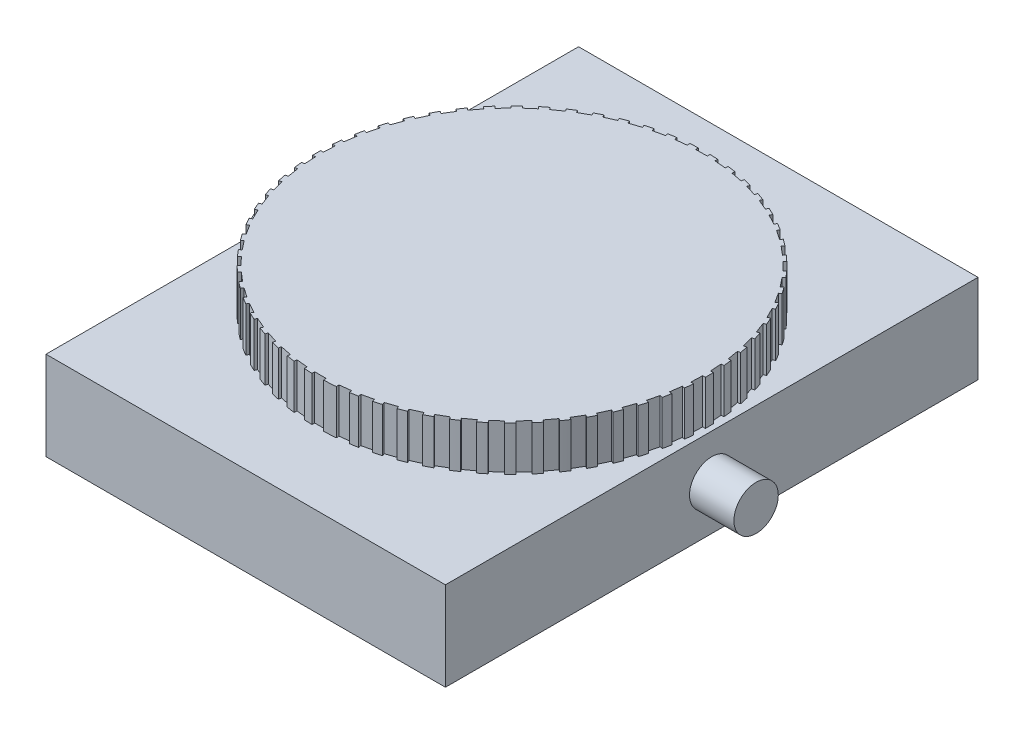
from build123d import *

# Parameters (mm, degrees)
SKETCH1_W           = 114.3
SKETCH1_H           = 152.4
BOSS_EXTRUDE1_DEPTH = 25.4
SKETCH2_R           = 55.610896722
BOSS_EXTRUDE2_DEPTH = 12.7
SKETCH3_W           = 3.278174466
SKETCH3_H           = 6.795753609
CUT_EXTRUDE1_DEPTH  = 99.578509321
CIRPATTERN1_COUNT   = 62
CIRPATTERN1_ANGLE   = 353
SKETCH4_R           = 6.35
BOSS_EXTRUDE3_DEPTH = 12.7


with BuildPart() as part:
    # Sketch1 → Boss-Extrude1 (new body)
    with BuildSketch(Plane(origin=(0, 0, 0), x_dir=(1, 0, 0), z_dir=(0, 1, 0))):
        Rectangle(SKETCH1_W, SKETCH1_H)
    extrude(amount=BOSS_EXTRUDE1_DEPTH)

    # Sketch4 → Boss-Extrude3 (add)
    with BuildSketch(Plane(origin=(57.15, 0, 0), x_dir=(0, 0, -1), z_dir=(1, 0, 0))):
        with Locations(Location((0, 12.7, 0), (0, 0, 180))):
            Circle(SKETCH4_R)
    boss_extrude3 = extrude(amount=BOSS_EXTRUDE3_DEPTH)

    # Mirror1: Boss-Extrude3 across plane
    add(boss_extrude3.mirror(Plane(origin=(0, 0, 0), x_dir=(0, 0, 1), z_dir=(1, 0, 0))))


with BuildPart() as body_2:
    # Sketch2 → Boss-Extrude2 (new body)
    with BuildSketch(Plane(origin=(0, 25.4, 0), x_dir=(1, 0, 0), z_dir=(0, 1, 0))):
        with Locations(Location((0, 0, 0), (0, 0, 270))):
            Circle(SKETCH2_R)
    extrude(amount=BOSS_EXTRUDE2_DEPTH)

    # Sketch3 → Cut-Extrude1 (cut, through all)
    with BuildSketch(Plane(origin=(0, 25.4, 0), x_dir=(1, 0, 0), z_dir=(0, 1, 0))):
        with Locations((0, -58.206471876)):
            Rectangle(SKETCH3_W, SKETCH3_H)
    cut_extrude1 = extrude(amount=CUT_EXTRUDE1_DEPTH, mode=Mode.SUBTRACT)

    # CirPattern1: Cut-Extrude1 ×62 about axis
    cirpattern1_axis = Axis((0, 0, 0), (0, -1, 0))
    for i in range(1, CIRPATTERN1_COUNT):
        add(cut_extrude1.rotate(cirpattern1_axis, i * CIRPATTERN1_ANGLE / (CIRPATTERN1_COUNT - 1)), mode=Mode.SUBTRACT)


solid = Compound([part.part, body_2.part])
